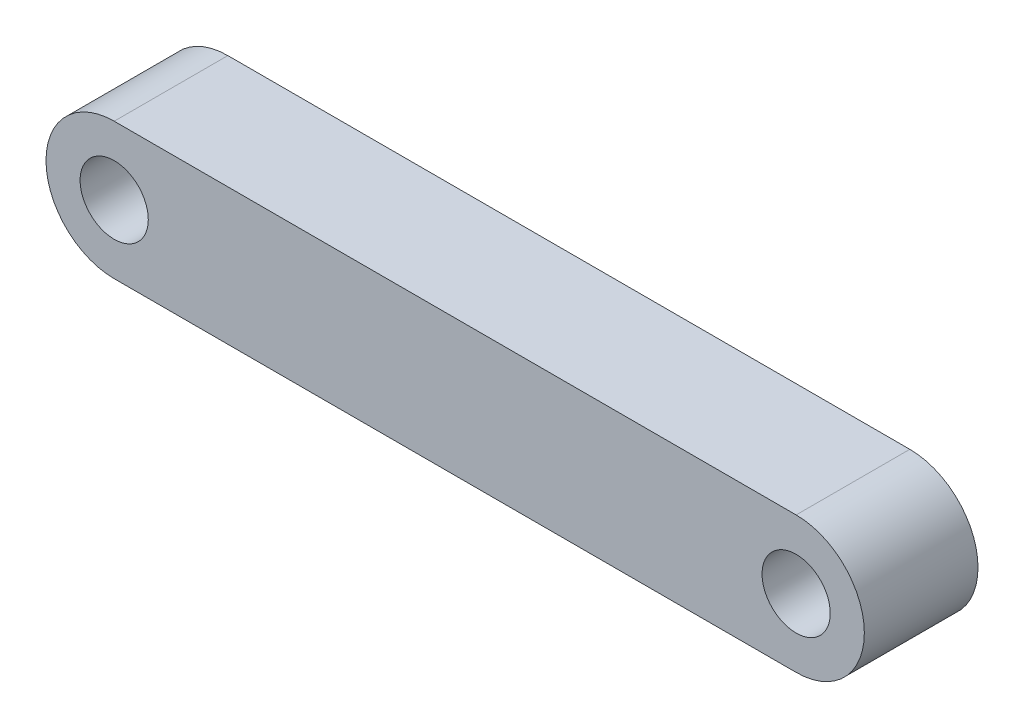
from build123d import *

# Parameters (mm, degrees)
ESQUISSE1_R        = 1.5
BOSS_EXTRU_1_DEPTH = 5


with BuildPart() as part:
    # Esquisse1 → Boss.-Extru.1 (new body)
    with BuildSketch(Plane.XY):
        with BuildLine():
            Line((-15, 3), (15, 3))
            ThreePointArc((15, 3), (18, 0), (15, -3))
            Line((15, -3), (-15, -3))
            ThreePointArc((-15, -3), (-18, 0), (-15, 3))
        make_face()
        with Locations((-15, 0)):
            Circle(ESQUISSE1_R, mode=Mode.SUBTRACT)
        with Locations((15, 0)):
            Circle(ESQUISSE1_R, mode=Mode.SUBTRACT)
    extrude(amount=BOSS_EXTRU_1_DEPTH)


solid = part.part
